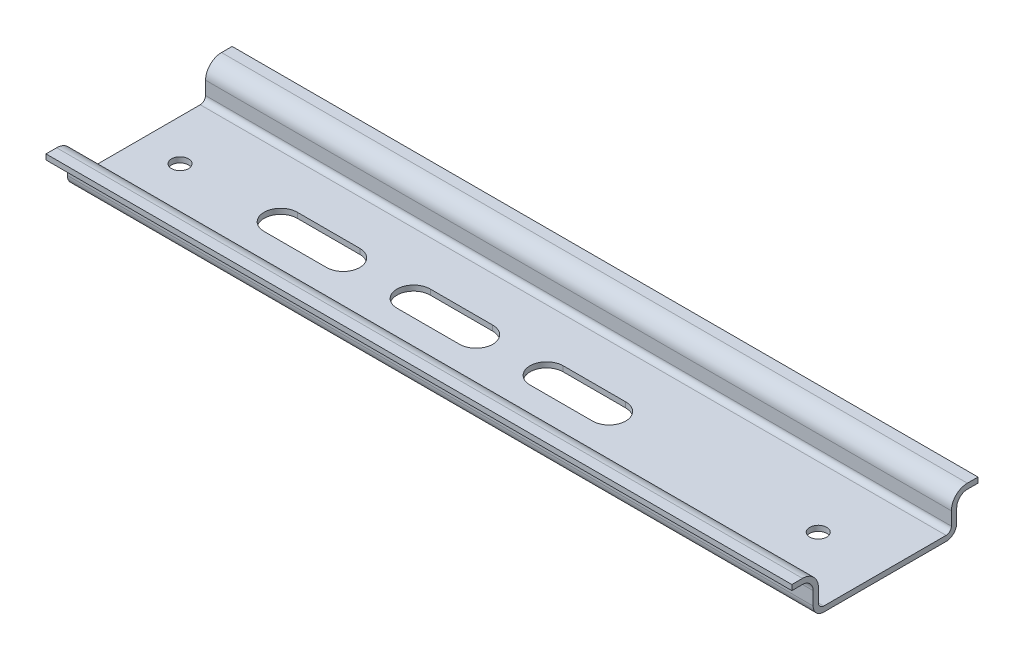
from build123d import *

# Parameters (mm, degrees)
EXTRUDE_THIN1_DEPTH        = 82.739
EXTRUDE_THIN1_DEPTH_BACK   = 57.5
CUT_EXTRUDE1_REACH         = 86.901
LPATTERN1_COUNT            = 2
LPATTERN1_PITCH            = 25
LPATTERN1_COL_COUNT        = 2
LPATTERN1_COL_PITCH        = 25
SZKIC1_R                   = 1.6
WYTNIJ_WYCI_GNI_CIE1_DEPTH = 85.901367015


with BuildPart() as part:
    # Sketch1 → Extrude-Thin1 (new, two sides: drawn at the far end of the back side and taken through both)
    with BuildSketch(Plane(origin=(0, 0, 0), x_dir=(0, 0, -1), z_dir=(1, 0, 0)).offset(-EXTRUDE_THIN1_DEPTH_BACK)):
        with BuildLine():
            Line((-17.5, 6.5), (-15.5, 6.5))
            ThreePointArc((-15.5, 6.5), (-14.085786438, 5.914213562), (-13.5, 4.5))
            Line((-13.5, 4.5), (-13.5, 2))
            ThreePointArc((-13.5, 2), (-12.914213562, 0.585786438), (-11.5, 0))
            Line((-11.5, 0), (11.5, 0))
            ThreePointArc((11.5, 0), (12.914213562, 0.585786438), (13.5, 2))
            Line((13.5, 2), (13.5, 4.5))
            ThreePointArc((13.5, 4.5), (14.085786438, 5.914213562), (15.5, 6.5))
            Line((15.5, 6.5), (17.5, 6.5))
            Line((17.5, 6.5), (17.5, 7.5))
            Line((17.5, 7.5), (15.5, 7.5))
            ThreePointArc((15.5, 7.5), (13.378679656, 6.621320344), (12.5, 4.5))
            Line((12.5, 4.5), (12.5, 2))
            ThreePointArc((12.5, 2), (12.207106781, 1.292893219), (11.5, 1))
            Line((11.5, 1), (-11.5, 1))
            ThreePointArc((-11.5, 1), (-12.207106781, 1.292893219), (-12.5, 2))
            Line((-12.5, 2), (-12.5, 4.5))
            ThreePointArc((-12.5, 4.5), (-13.378679656, 6.621320344), (-15.5, 7.5))
            Line((-15.5, 7.5), (-17.5, 7.5))
            Line((-17.5, 7.5), (-17.5, 6.5))
        make_face()
    extrude(amount=EXTRUDE_THIN1_DEPTH + EXTRUDE_THIN1_DEPTH_BACK)

    # Sketch2 → Cut-Extrude1 (cut, up to next)
    with BuildSketch(Plane.XZ, mode=Mode.PRIVATE) as cut_extrude1_sk1:
        with BuildLine():
            Line((-5.875, 3.125), (5.875, 3.125))
            ThreePointArc((5.875, 3.125), (9, 0), (5.875, -3.125))
            Line((5.875, -3.125), (-5.875, -3.125))
            ThreePointArc((-5.875, -3.125), (-9, 0), (-5.875, 3.125))
        make_face()
    cut_extrude1_tool1 = extrude(cut_extrude1_sk1.sketch, amount=-CUT_EXTRUDE1_REACH, mode=Mode.PRIVATE) & part.part
    cut_extrude1 = cut_extrude1_tool1.solids().sort_by_distance((0, 0, 0))[0]
    add(cut_extrude1, mode=Mode.SUBTRACT)

    # LPattern1: Cut-Extrude1 ×2
    with Locations(*[(i * LPATTERN1_PITCH, 0, 0) for i in range(1, LPATTERN1_COUNT)]):
        add(cut_extrude1, mode=Mode.SUBTRACT)

    # LPattern1 col: Cut-Extrude1 ×2
    with Locations(*[(-i * LPATTERN1_COL_PITCH, 0, 0) for i in range(1, LPATTERN1_COL_COUNT)]):
        add(cut_extrude1, mode=Mode.SUBTRACT)

    # Szkic1 → Wytnij-wyciągnięcie1 (cut, through all)
    with BuildSketch(Plane.XZ):
        with Locations(Location((70.2, 0, 0), (0, 0, 270))):
            Circle(SZKIC1_R)
        with Locations(Location((-49.8, 0, 0), (0, 0, 270))):
            Circle(SZKIC1_R)
    extrude(amount=-WYTNIJ_WYCI_GNI_CIE1_DEPTH, mode=Mode.SUBTRACT)


solid = part.part
